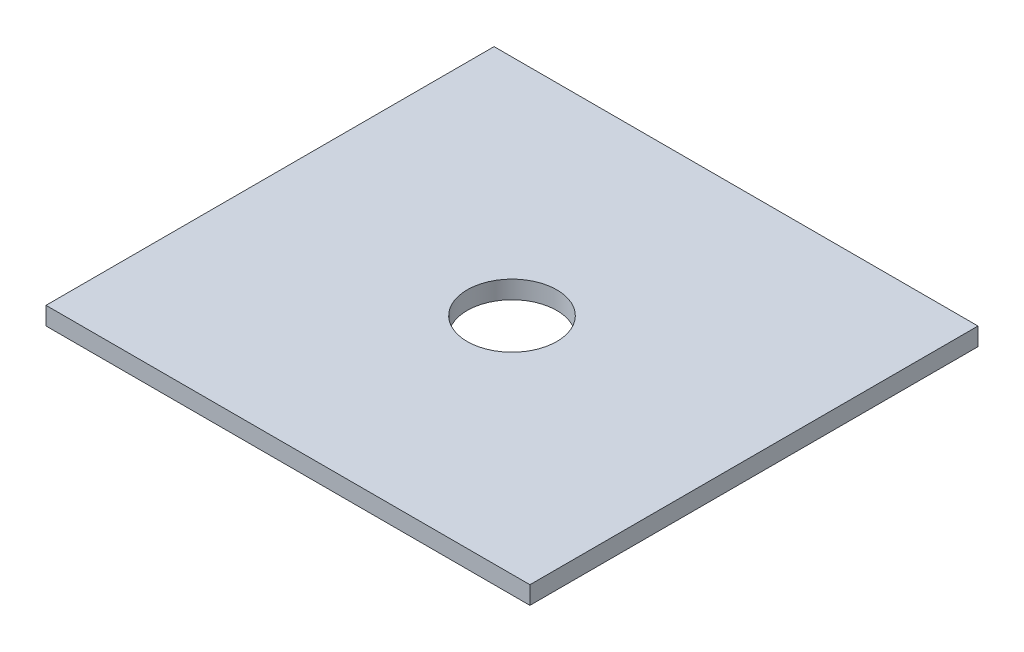
from build123d import *

# Parameters (mm, degrees)
SKETCH1_W           = 54
SKETCH1_H           = 50
SKETCH1_R           = 5
BOSS_EXTRUDE1_DEPTH = 2


with BuildPart() as part:
    # Sketch1 → Boss-Extrude1 (new body)
    with BuildSketch(Plane(origin=(0, 0, 0), x_dir=(1, 0, 0), z_dir=(0, 1, 0))):
        with Locations((27, 25)):
            Rectangle(SKETCH1_W, SKETCH1_H)
        with Locations(Location((27, 25, 0), (0, 0, 270))):
            Circle(SKETCH1_R, mode=Mode.SUBTRACT)
    extrude(amount=BOSS_EXTRUDE1_DEPTH)


solid = part.part
